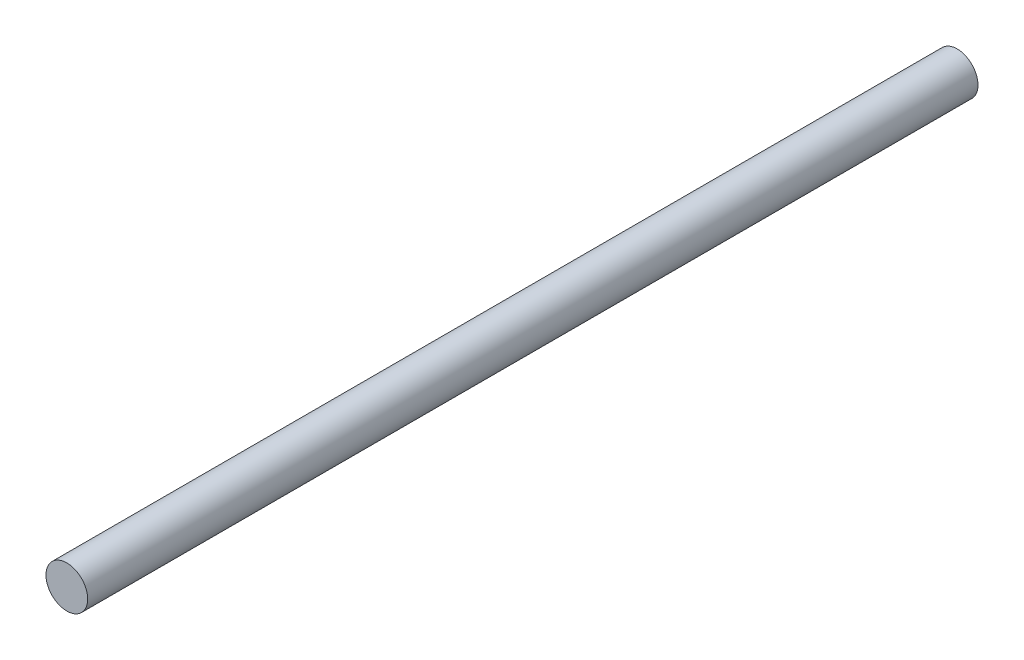
from build123d import *

# Parameters (mm, degrees)
SKETCH1_R           = 4.7625
BOSS_EXTRUDE1_DEPTH = 203.2


with BuildPart() as part:
    # Sketch1 → Boss-Extrude1 (new body)
    with BuildSketch(Plane.XY):
        Circle(SKETCH1_R)
    extrude(amount=BOSS_EXTRUDE1_DEPTH)


solid = part.part
